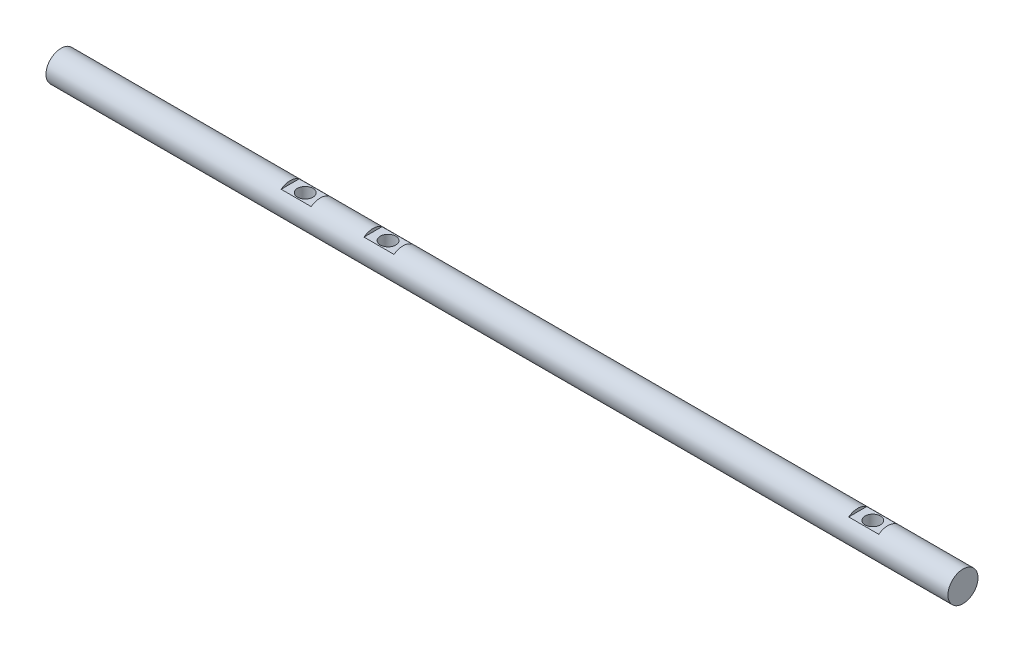
from build123d import *

# Parameters (mm, degrees)
SKETCH1_R               = 3.175
BOSS_EXTRUDE1_DEPTH     = 190.5
CUT_EXTRUDE1_DEPTH      = 191.552909319
CUT_EXTRUDE1_DEPTH_BACK = 191.552909319
SKETCH2_R               = 1.63195
CUT_EXTRUDE2_START      = 2.54
SKETCH2_3_W             = 6.35
SKETCH2_3_H             = 11.745313468
SKETCH2_3_R             = 1.63195
SKETCH2_3_H_2           = 14.521129012
CUT_EXTRUDE2_DEPTH      = 189.012909422


with BuildPart() as part:
    # Sketch1 → Boss-Extrude1 (new body)
    with BuildSketch(Plane(origin=(0, 0, 0), x_dir=(0, 0, -1), z_dir=(1, 0, 0))):
        Circle(SKETCH1_R)
    extrude(amount=BOSS_EXTRUDE1_DEPTH)

    # Sketch2 → Cut-Extrude1 (cut, two sides: drawn at the far end of the back side and taken through both)
    with BuildSketch(Plane(origin=(0, 0, 0), x_dir=(1, 0, 0), z_dir=(0, 1, 0)).offset(-CUT_EXTRUDE1_DEPTH_BACK)):
        with Locations((171.45, 0)):
            Circle(SKETCH2_R)
        with Locations((51.575, 0)):
            Circle(SKETCH2_R)
        with Locations((69.075, 0)):
            Circle(SKETCH2_R)
    extrude(amount=CUT_EXTRUDE1_DEPTH + CUT_EXTRUDE1_DEPTH_BACK, mode=Mode.SUBTRACT)

    # Sketch2<3> → Cut-Extrude2 (cut, through all)
    # profile 1 of 3: a face of its own
    with BuildSketch(Plane(origin=(0, 0, 0), x_dir=(1, 0, 0), z_dir=(0, 1, 0)).offset(CUT_EXTRUDE2_START)):
        with Locations((69.075, 0)):
            Rectangle(SKETCH2_3_W, SKETCH2_3_H)
        with Locations((69.075, 0)):
            Circle(SKETCH2_3_R, mode=Mode.SUBTRACT)
    # profile 2 of 3: a face of its own
    with BuildSketch(Plane(origin=(0, 0, 0), x_dir=(1, 0, 0), z_dir=(0, 1, 0)).offset(CUT_EXTRUDE2_START)):
        with Locations((51.575, 0)):
            Rectangle(SKETCH2_3_W, SKETCH2_3_H)
        with Locations((51.575, 0)):
            Circle(SKETCH2_3_R, mode=Mode.SUBTRACT)
    # profile 3 of 3: a face of its own
    with BuildSketch(Plane(origin=(0, 0, 0), x_dir=(1, 0, 0), z_dir=(0, 1, 0)).offset(CUT_EXTRUDE2_START)):
        with Locations((171.45, 0)):
            Rectangle(SKETCH2_3_W, SKETCH2_3_H_2)
        with Locations((171.45, 0)):
            Circle(SKETCH2_3_R, mode=Mode.SUBTRACT)
    extrude(amount=CUT_EXTRUDE2_DEPTH, mode=Mode.SUBTRACT)


solid = part.part
